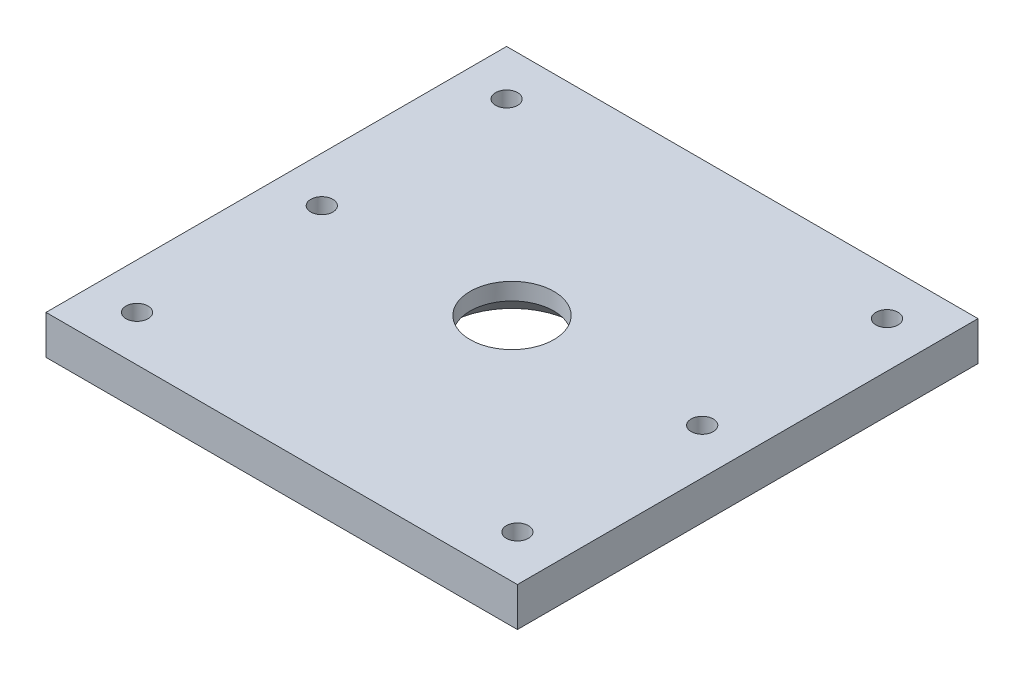
from build123d import *

# Parameters (mm, degrees)
SKETCH1_W           = 76.76
SKETCH1_H           = 75
BOSS_EXTRUDE1_DEPTH = 6.35
SKETCH2_R           = 6.815
CUT_EXTRUDE1_DEPTH  = 55.033294366
SKETCH3_R           = 1.8
CUT_EXTRUDE2_DEPTH  = 55.033294366
CHAMFER1_SIZE       = 3.58


with BuildPart() as part:
    # Sketch1 → Boss-Extrude1 (new body)
    with BuildSketch(Plane(origin=(0, 0, 0), x_dir=(1, 0, 0), z_dir=(0, 1, 0))):
        Rectangle(SKETCH1_W, SKETCH1_H)
    extrude(amount=BOSS_EXTRUDE1_DEPTH)

    # Sketch2 → Cut-Extrude1 (cut, through all)
    with BuildSketch(Plane(origin=(0, 6.35, 0), x_dir=(1, 0, 0), z_dir=(0, 1, 0))):
        with Locations(Location((0, 0, 0), (0, 0, 270))):
            Circle(SKETCH2_R)
    extrude(amount=-CUT_EXTRUDE1_DEPTH, mode=Mode.SUBTRACT)

    # Sketch3 → Cut-Extrude2 (cut, through all)
    with BuildSketch(Plane(origin=(0, 6.35, 0), x_dir=(1, 0, 0), z_dir=(0, 1, 0))):
        with Locations(Location((-30.97, 30.09, 0), (0, 0, 270))):
            Circle(SKETCH3_R)
        with Locations(Location((-30.97, -30.09, 0), (0, 0, 270))):
            Circle(SKETCH3_R)
        with Locations(Location((30.97, -30.09, 0), (0, 0, 270))):
            Circle(SKETCH3_R)
        with Locations(Location((30.97, 30.09, 0), (0, 0, 270))):
            Circle(SKETCH3_R)
        with Locations(Location((-30.97, 0, 0), (0, 0, 270))):
            Circle(SKETCH3_R)
        with Locations(Location((30.97, 0, 0), (0, 0, 270))):
            Circle(SKETCH3_R)
    extrude(amount=-CUT_EXTRUDE2_DEPTH, mode=Mode.SUBTRACT)

    # Chamfer1
    chamfer1_edges = [part.edges().sort_by_distance(p)[0] for p in [
        (0, 0, -6.815),
    ]]
    chamfer(chamfer1_edges, length=CHAMFER1_SIZE)


solid = part.part
